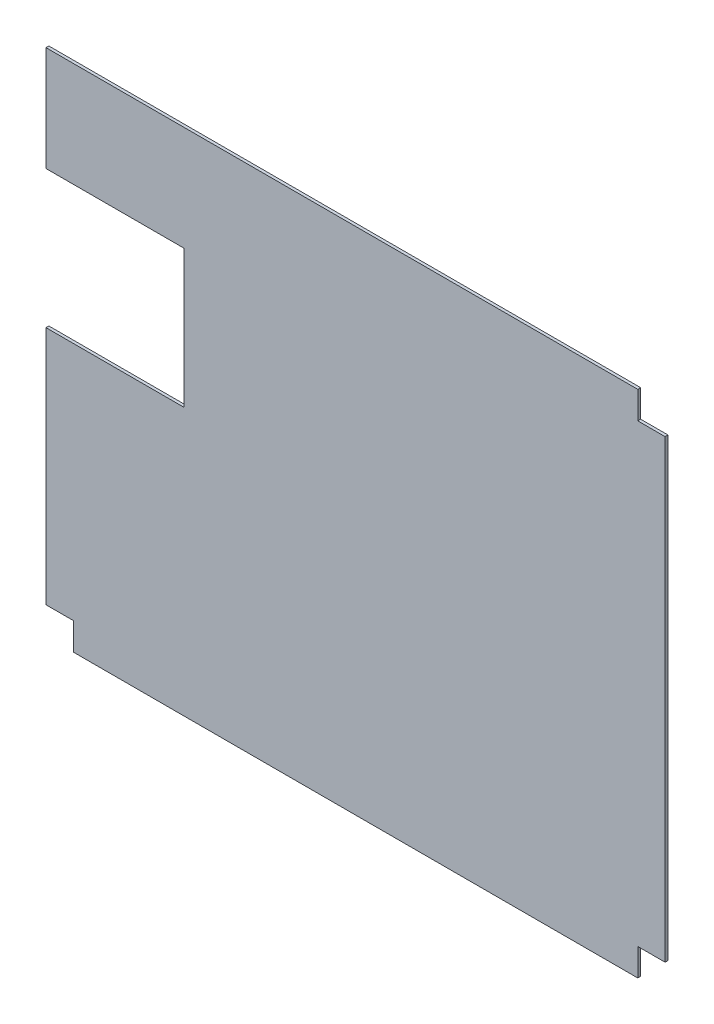
from build123d import *

# Parameters (mm, degrees)
SALIENTE_EXTRUIR1_DEPTH = 3.175
CORTAR_EXTRUIR1_DEPTH   = 10


with BuildPart() as part:
    # Croquis1 → Saliente-Extruir1 (new body)
    with BuildSketch(Plane.XY):
        Polygon((-205.770387244, 310.6), (-205.770387244, -74.4), (-175.770387244, -74.4), (-175.770387244, -104.4), (444.229612756, -104.4), (444.229612756, -74.4), (474.229612756, -74.4), (474.229612756, 425.6), (444.229612756, 425.6), (444.229612756, 455.6), (-205.770387244, 455.6), (-205.770387244, 340.6), (-175.770387244, 340.6), (-175.770387244, 310.6), align=None)
    extrude(amount=SALIENTE_EXTRUIR1_DEPTH)

    # Croquis2 → Cortar-Extruir1 (cut)
    with BuildSketch(Plane.XY.offset(3.175)):
        Polygon((-205.770387244, 310.6), (-175.770387244, 310.6), (-175.770387244, 340.6), (-54.420387244, 340.6), (-54.420387244, 189.25), (-205.770387244, 189.25), align=None)
    extrude(amount=-CORTAR_EXTRUIR1_DEPTH, mode=Mode.SUBTRACT)


solid = part.part
